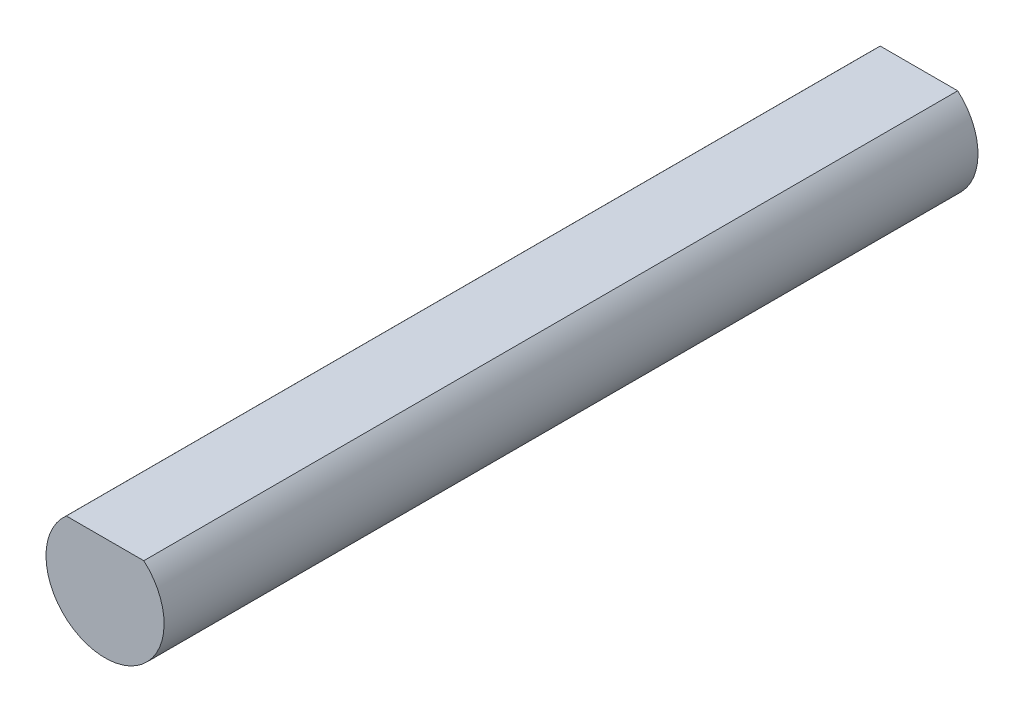
from build123d import *

# Parameters (mm, degrees)
BOSS_EXTRUDE1_DEPTH = 27.5


with BuildPart() as part:
    # Sketch1 → Boss-Extrude1 (new, symmetric)
    with BuildSketch(Plane.XY):
        with BuildLine():
            Line((-2.619160171, 3.01), (2.619160171, 3.01))
            ThreePointArc((2.619160171, 3.01), (0, -3.99), (-2.619160171, 3.01))
        make_face()
    extrude(amount=BOSS_EXTRUDE1_DEPTH, both=True)


solid = part.part
